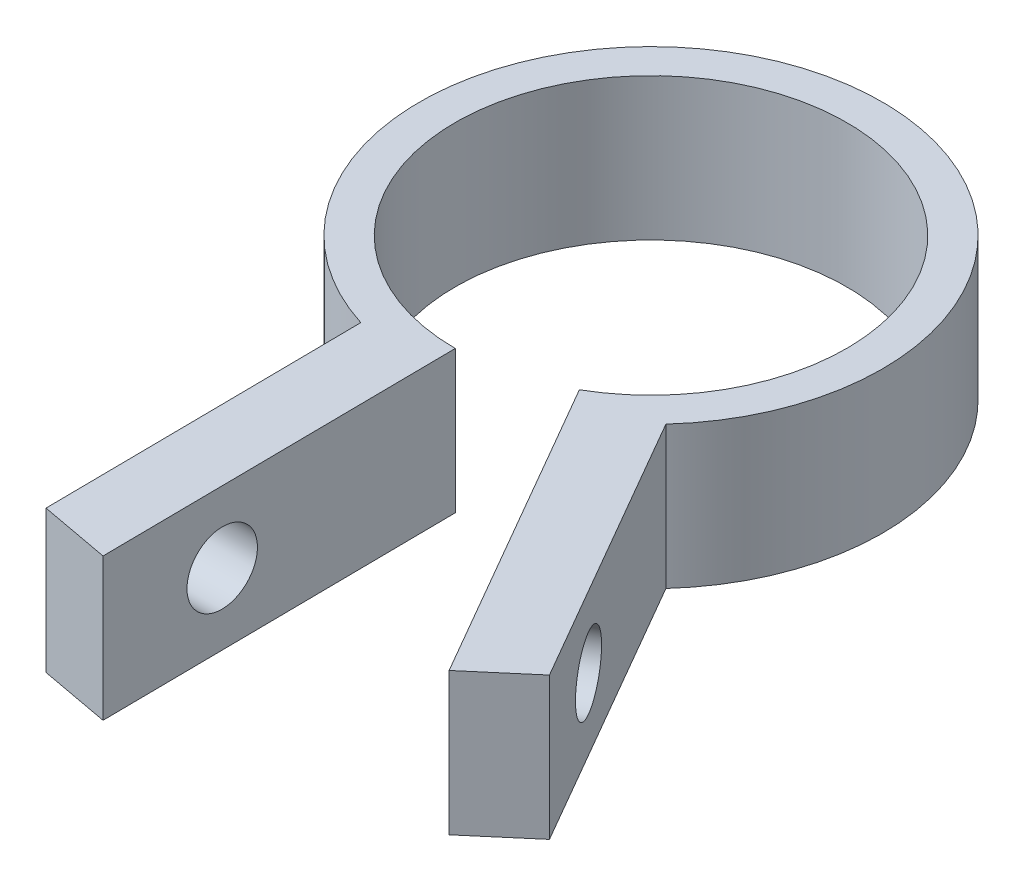
from build123d import *

# Parameters (mm, degrees)
BOSS_EXTRUDE1_DEPTH = 4
CUT_EXTRUDE1_REACH  = 21.572
SKETCH3_R           = 1
CUT_EXTRUDE2_REACH  = 20.841
SKETCH5_R           = 1


with BuildPart() as part:
    # Sketch2 → Boss-Extrude1 (new body)
    with BuildSketch(Plane(origin=(0, 0, 0), x_dir=(1, 0, 0), z_dir=(0, 1, 0))):
        with BuildLine():
            Line((-1.955885444, -6.198750852), (-1.966664332, -5.136363636))
            ThreePointArc((-1.966664332, -5.136363636), (-1.423504748, 5.312592045), (4.27136309, -3.464889226))
            Line((4.27136309, -3.464889226), (4.800851018, -4.381989218))
            ThreePointArc((4.800851018, -4.381989218), (-1.687783454, 6.277052414), (-1.955885444, -6.198750852))
        make_face()
        with BuildLine():
            Line((0, -6.5), (0, -5.5))
            ThreePointArc((0, -5.5), (-1, -5.408326913), (-1.966664332, -5.136363636))
            Line((-1.966664332, -5.136363636), (-1.955885444, -6.198750852))
            ThreePointArc((-1.955885444, -6.198750852), (-0.989474472, -6.42424628), (0, -6.5))
        make_face()
        with BuildLine():
            ThreePointArc((4.27136309, -3.464889226), (3.57018886, -4.183748499), (2.75, -4.763139721))
            Line((2.75, -4.763139721), (3.25, -5.629165125))
            ThreePointArc((3.25, -5.629165125), (4.073439881, -5.065282572), (4.800851018, -4.381989218))
            Line((4.800851018, -4.381989218), (4.27136309, -3.464889226))
        make_face()
        with BuildLine():
            ThreePointArc((4.800851018, -4.381989218), (4.073439881, -5.065282572), (3.25, -5.629165125))
            Line((3.25, -5.629165125), (7.75, -13.423393759))
            Line((7.75, -13.423393759), (9.27136309, -12.125143264))
            Line((9.27136309, -12.125143264), (4.800851018, -4.381989218))
        make_face()
        with BuildLine():
            Line((0.101453905, -15.499485342), (0, -5.5))
            Line((0, -5.5), (0, -6.5))
            ThreePointArc((0, -6.5), (-0.989474472, -6.42424628), (-1.955885444, -6.198750852))
            Line((-1.955885444, -6.198750852), (-1.865210427, -15.135848978))
            Line((-1.865210427, -15.135848978), (0.101453905, -15.499485342))
        make_face()
    extrude(amount=BOSS_EXTRUDE1_DEPTH)

    # Sketch3 → Cut-Extrude1 (cut, up to next)
    with BuildSketch(Plane(origin=(-2.018569638, 0, 0.020480231), x_dir=(0.010145390476883202, 0, 0.9999485342016716), z_dir=(-0.9999485342016717, 0, 0.010145390476883204)), mode=Mode.PRIVATE) as cut_extrude1_sk1:
        with Locations((12.116146712, 2)):
            Circle(SKETCH3_R)
    cut_extrude1_tool1 = extrude(cut_extrude1_sk1.sketch, amount=-CUT_EXTRUDE1_REACH, mode=Mode.PRIVATE) & part.part
    add(cut_extrude1_tool1.solids().sort_by_distance((-1.895647, 2, 12.136003))[0], mode=Mode.SUBTRACT)

    # Sketch5 → Cut-Extrude2 (cut, up to next)
    with BuildSketch(Plane(origin=(1.703181272, 0, -0.983332166), x_dir=(-0.5000000000000019, 0, -0.8660254037844377), z_dir=(0.8660254037844377, 0, -0.5000000000000019)), mode=Mode.PRIVATE) as cut_extrude2_sk1:
        with Locations((-12.136363636, 2)):
            Circle(SKETCH5_R)
    cut_extrude2_tool1 = extrude(cut_extrude2_sk1.sketch, amount=-CUT_EXTRUDE2_REACH, mode=Mode.PRIVATE) & part.part
    add(cut_extrude2_tool1.solids().sort_by_distance((7.771363, 2, 9.527067))[0], mode=Mode.SUBTRACT)


solid = part.part
